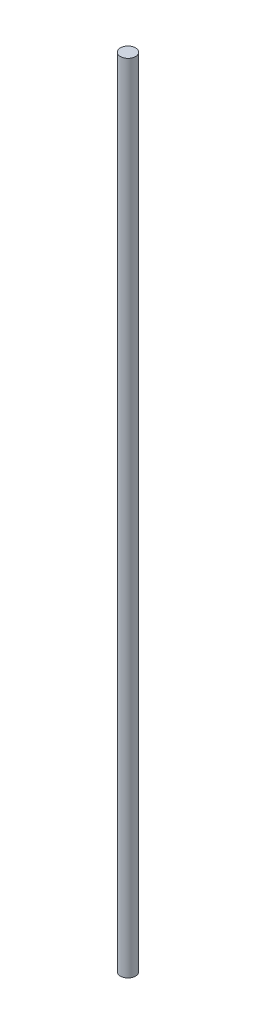
from build123d import *

# Parameters (mm, degrees)
SKETCH1_R           = 4
BOSS_EXTRUDE1_DEPTH = 420


with BuildPart() as part:
    # Sketch1 → Boss-Extrude1 (new body)
    with BuildSketch(Plane(origin=(0, 0, 0), x_dir=(1, 0, 0), z_dir=(0, 1, 0))):
        with Locations(Location((0, 0, 0), (0, 0, 180))):
            Circle(SKETCH1_R)
    extrude(amount=BOSS_EXTRUDE1_DEPTH)


solid = part.part
